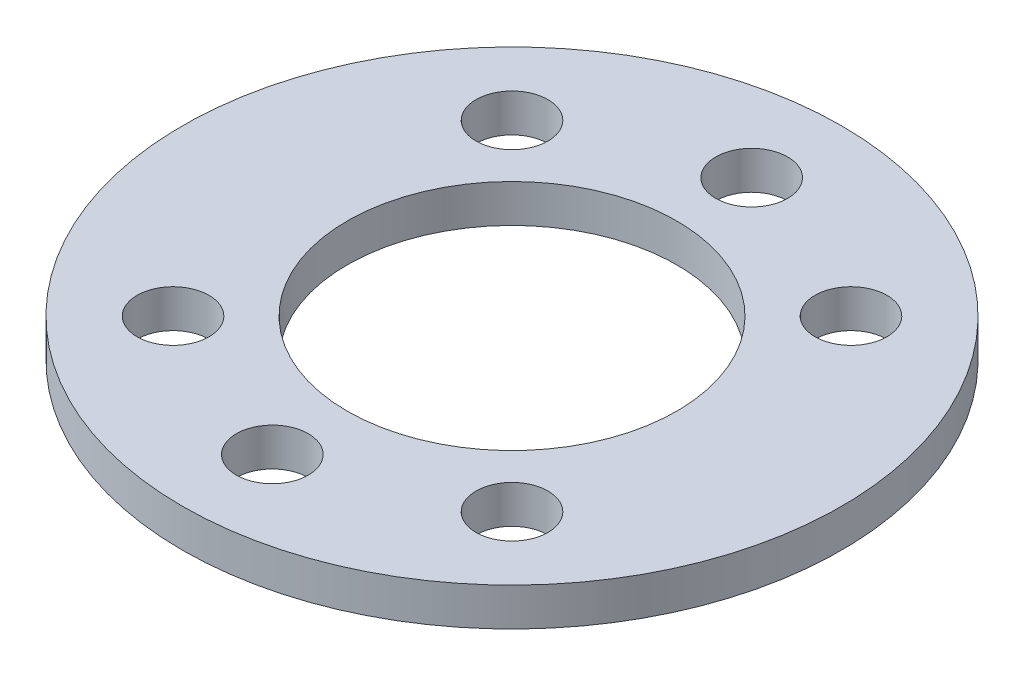
from build123d import *

# Parameters (mm, degrees)
SKETCH1_R           = 22
SKETCH1_R_2         = 11
BOSS_EXTRUDE1_DEPTH = 2.54
SKETCH2_R           = 2.4
CUT_EXTRUDE1_DEPTH  = 10


with BuildPart() as part:
    # Sketch1 → Boss-Extrude1 (new body)
    with BuildSketch(Plane(origin=(0, 0, 0), x_dir=(1, 0, 0), z_dir=(0, 1, 0))):
        with Locations(Location((0, 0, 0), (0, 0, 270))):
            Circle(SKETCH1_R)
        with Locations(Location((0, 0, 0), (0, 0, 270))):
            Circle(SKETCH1_R_2, mode=Mode.SUBTRACT)
    extrude(amount=BOSS_EXTRUDE1_DEPTH)

    # Sketch2 → Cut-Extrude1 (cut)
    with BuildSketch(Plane(origin=(0, 2.54, 0), x_dir=(1, 0, 0), z_dir=(0, 1, 0))):
        with Locations(Location((0, 16, 0), (0, 0, 270))):
            Circle(SKETCH2_R)
        with Locations(Location((-11.313708499, 11.313708499, 0), (0, 0, 270))):
            Circle(SKETCH2_R)
        with Locations(Location((11.313708499, 11.313708499, 0), (0, 0, 270))):
            Circle(SKETCH2_R)
        with Locations(Location((11.313708499, -11.313708499, 0), (0, 0, 270))):
            Circle(SKETCH2_R)
        with Locations(Location((0, -16, 0), (0, 0, 270))):
            Circle(SKETCH2_R)
        with Locations(Location((-11.313708499, -11.313708499, 0), (0, 0, 270))):
            Circle(SKETCH2_R)
    extrude(amount=-CUT_EXTRUDE1_DEPTH, mode=Mode.SUBTRACT)


solid = part.part
